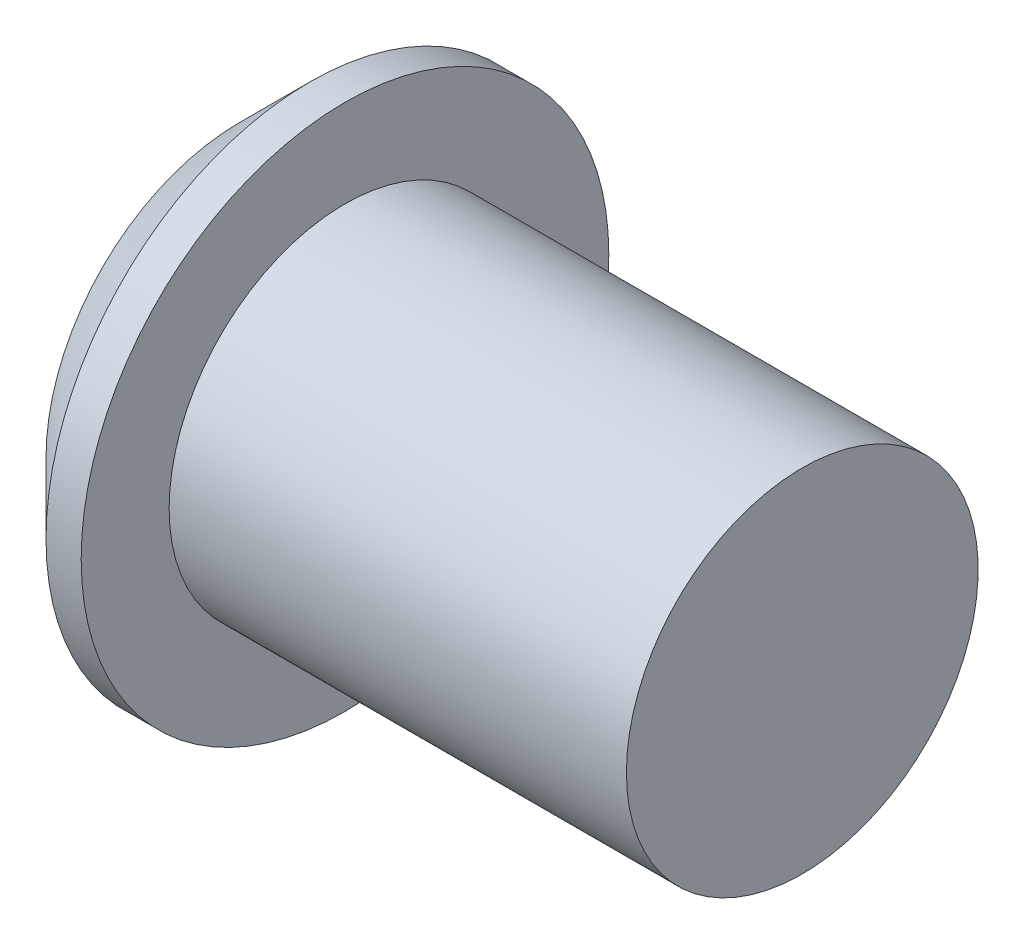
from build123d import *

# Parameters (mm, degrees)
SKETCH1_R           = 5
BOSS_EXTRUDE1_DEPTH = 13
SKETCH2_R           = 7.5
BOSS_EXTRUDE2_DEPTH = 3
CHAMFER1_SIZE       = 2


with BuildPart() as part:
    # Sketch1 → Boss-Extrude1 (new body)
    with BuildSketch(Plane(origin=(0, 0, 0), x_dir=(0, 0, -1), z_dir=(1, 0, 0))):
        with Locations(Location((0, 0, 0), (0, 0, 180))):
            Circle(SKETCH1_R)
    extrude(amount=BOSS_EXTRUDE1_DEPTH)

    # Sketch2 → Boss-Extrude2 (add)
    with BuildSketch(Plane.ZY):
        Circle(SKETCH2_R)
    extrude(amount=BOSS_EXTRUDE2_DEPTH)

    # Chamfer1
    chamfer1_edges = [part.edges().sort_by_distance(p)[0] for p in [
        (-3, 0, -7.5),
    ]]
    chamfer(chamfer1_edges, length=CHAMFER1_SIZE)


solid = part.part
